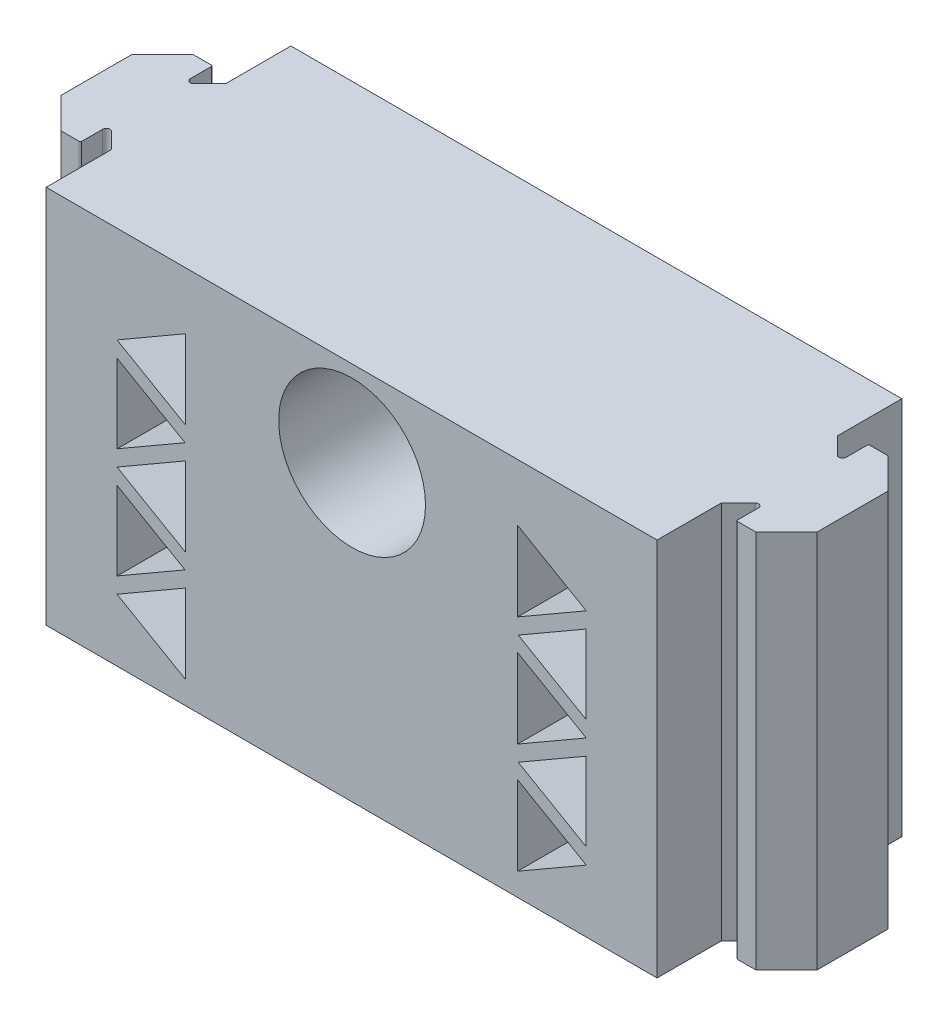
from build123d import *

# Parameters (mm, degrees)
BOSS_EXTRU_1_DEPTH      = 24
ESQUISSE3_R             = 6
ENL_V_MAT_EXTRU_2_DEPTH = 44.940983148
BOSS_EXTRU_2_START      = 7
BOSS_EXTRU_2_DEPTH      = 7
ENL_V_MAT_EXTRU_3_DEPTH = 44.940983148


with BuildPart() as part:
    # Esquisse1 → Boss.-Extru.1 (new body)
    with BuildSketch(Plane(origin=(0, 0, 0), x_dir=(1, 0, 0), z_dir=(0, 1, 0))):
        with BuildLine():
            Line((-25, -4.8), (-25, -10))
            Line((-25, -10), (24.929289322, -10))
            Line((24.929289322, -10), (24.929289322, -4.729289322))
            Line((24.929289322, -4.729289322), (26.287867966, -3.370710678))
            ThreePointArc((26.287867966, -3.370710678), (26.61480503, -3.305678853), (26.8, -3.582842712))
            Line((26.8, -3.582842712), (26.8, -5.3))
            ThreePointArc((26.8, -5.3), (26.829289322, -5.370710678), (26.9, -5.4))
            Line((26.9, -5.4), (28.397918472, -5.4))
            Line((28.397918472, -5.4), (30.9, -2.897918472))
            Line((30.9, -2.897918472), (30.9, -0.241421356))
            Line((30.9, -0.241421356), (30.9, 0.241421356))
            Line((30.9, 0.241421356), (30.9, 2.897918472))
            Line((30.9, 2.897918472), (28.397918472, 5.4))
            Line((28.397918472, 5.4), (26.9, 5.4))
            ThreePointArc((26.9, 5.4), (26.829289322, 5.370710678), (26.8, 5.3))
            Line((26.8, 5.3), (26.8, 3.582842712))
            ThreePointArc((26.8, 3.582842712), (26.61480503, 3.305678853), (26.287867966, 3.370710678))
            Line((26.287867966, 3.370710678), (24.929289322, 4.729289322))
            Line((24.929289322, 4.729289322), (24.929289322, 10))
            Line((24.929289322, 10), (-25, 10))
            Line((-25, 10), (-25, 4.8))
            Line((-25, 4.8), (-25, 4.658578644))
            Line((-25, 4.658578644), (-26.287867966, 3.370710678))
            ThreePointArc((-26.287867966, 3.370710678), (-26.61480503, 3.305678853), (-26.8, 3.582842712))
            Line((-26.8, 3.582842712), (-26.8, 5.3))
            ThreePointArc((-26.8, 5.3), (-26.829289322, 5.370710678), (-26.9, 5.4))
            Line((-26.9, 5.4), (-28.397918472, 5.4))
            Line((-28.397918472, 5.4), (-30.9, 2.897918472))
            Line((-30.9, 2.897918472), (-30.9, 0.241421356))
            Line((-30.9, 0.241421356), (-30.9, -0.241421356))
            Line((-30.9, -0.241421356), (-30.9, -2.897918472))
            Line((-30.9, -2.897918472), (-28.397918472, -5.4))
            Line((-28.397918472, -5.4), (-26.9, -5.4))
            ThreePointArc((-26.9, -5.4), (-26.829289322, -5.370710678), (-26.8, -5.3))
            Line((-26.8, -5.3), (-26.8, -3.582842712))
            ThreePointArc((-26.8, -3.582842712), (-26.61480503, -3.305678853), (-26.287867966, -3.370710678))
            Line((-26.287867966, -3.370710678), (-25, -4.658578644))
            Line((-25, -4.658578644), (-25, -4.8))
        make_face()
    extrude(amount=BOSS_EXTRU_1_DEPTH)

    # Esquisse3 → Enlèv. mat.-Extru.2 (cut, through all)
    with BuildSketch(Plane.XY.offset(10)):
        with Locations((0, 17)):
            Circle(ESQUISSE3_R)
    extrude(amount=-ENL_V_MAT_EXTRU_2_DEPTH, mode=Mode.SUBTRACT)

    # Esquisse5 → Boss.-Extru.2 (add)
    with BuildSketch(Plane.XZ.offset(BOSS_EXTRU_2_START)):
        with BuildLine():
            Line((-25, -4.658578644), (-25, -10))
            Line((-25, -10), (24.929289322, -10))
            Line((24.929289322, -10), (24.929289322, -4.729289322))
            Line((24.929289322, -4.729289322), (26.287867966, -3.370710678))
            ThreePointArc((26.287867966, -3.370710678), (26.61480503, -3.305678853), (26.8, -3.582842712))
            Line((26.8, -3.582842712), (26.8, -5.3))
            ThreePointArc((26.8, -5.3), (26.829289322, -5.370710678), (26.9, -5.4))
            Line((26.9, -5.4), (28.397918472, -5.4))
            Line((28.397918472, -5.4), (30.9, -2.897918472))
            Line((30.9, -2.897918472), (30.9, 2.897918472))
            Line((30.9, 2.897918472), (28.397918472, 5.4))
            Line((28.397918472, 5.4), (26.9, 5.4))
            ThreePointArc((26.9, 5.4), (26.829289322, 5.370710678), (26.8, 5.3))
            Line((26.8, 5.3), (26.8, 3.582842712))
            ThreePointArc((26.8, 3.582842712), (26.61480503, 3.305678853), (26.287867966, 3.370710678))
            Line((26.287867966, 3.370710678), (24.929289322, 4.729289322))
            Line((24.929289322, 4.729289322), (24.929289322, 10))
            Line((24.929289322, 10), (-25, 10))
            Line((-25, 10), (-25, 4.658578644))
            Line((-25, 4.658578644), (-26.287867966, 3.370710678))
            ThreePointArc((-26.287867966, 3.370710678), (-26.61480503, 3.305678853), (-26.8, 3.582842712))
            Line((-26.8, 3.582842712), (-26.8, 5.3))
            ThreePointArc((-26.8, 5.3), (-26.829289322, 5.370710678), (-26.9, 5.4))
            Line((-26.9, 5.4), (-28.397918472, 5.4))
            Line((-28.397918472, 5.4), (-30.9, 2.897918472))
            Line((-30.9, 2.897918472), (-30.9, -2.897918472))
            Line((-30.9, -2.897918472), (-28.397918472, -5.4))
            Line((-28.397918472, -5.4), (-26.9, -5.4))
            ThreePointArc((-26.9, -5.4), (-26.829289322, -5.370710678), (-26.8, -5.3))
            Line((-26.8, -5.3), (-26.8, -3.582842712))
            ThreePointArc((-26.8, -3.582842712), (-26.61480503, -3.305678853), (-26.287867966, -3.370710678))
            Line((-26.287867966, -3.370710678), (-25, -4.658578644))
        make_face()
    extrude(amount=-BOSS_EXTRU_2_DEPTH)

    # Esquisse6 → Enlèv. mat.-Extru.3 (cut, through all)
    with BuildSketch(Plane.XY.offset(10)):
        Polygon((-19.197823099, 5.798124654), (-19.197823099, -0.606864634), (-13.650939664, 2.59563001), align=None)
        Polygon((-13.597630982, 10.337724739), (-19.211418501, 7.092391283), (-13.593983525, 3.853375408), align=None)
        Polygon((-19.211418501, -1.907608717), (-13.593983525, -5.146624592), (-13.597630982, 1.337724739), align=None)
        Polygon((-13.597630982, 19.337724739), (-19.211418501, 16.092391283), (-13.593983525, 12.853375408), align=None)
        Polygon((-19.197823099, 8.393135366), (-13.650939664, 11.59563001), (-19.197823099, 14.798124654), align=None)
        Polygon((19.12711242, -0.606864634), (13.580228986, 2.59563001), (19.12711242, 5.798124654), align=None)
        Polygon((19.12711242, 14.798124654), (19.12711242, 8.393135366), (13.580228986, 11.59563001), align=None)
        Polygon((13.523272847, 12.853375408), (13.526920304, 19.337724739), (19.140707823, 16.092391283), align=None)
        Polygon((13.523272847, 3.853375408), (13.526920304, 10.337724739), (19.140707823, 7.092391283), align=None)
        Polygon((13.526920304, 1.337724739), (19.140707823, -1.907608717), (13.523272847, -5.146624592), align=None)
    extrude(amount=-ENL_V_MAT_EXTRU_3_DEPTH, mode=Mode.SUBTRACT)


solid = part.part
